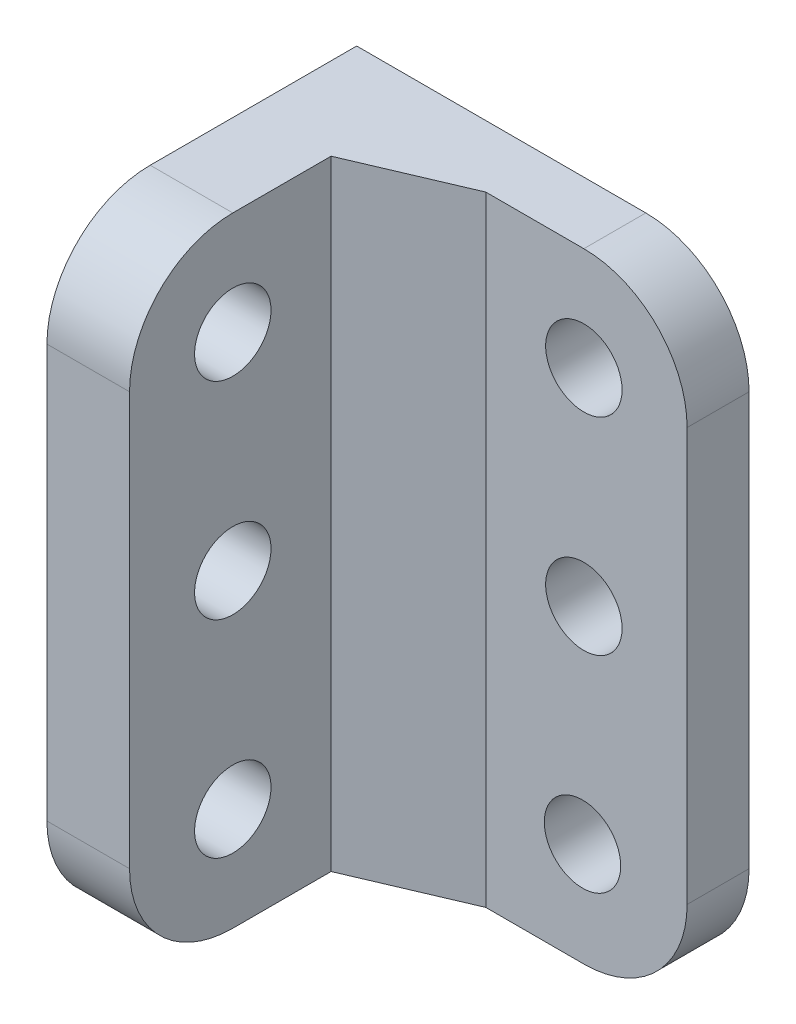
from build123d import *

# Parameters (mm, degrees)
BASE_EXTRUDE_DEPTH      = 38.1
SKETCH2_R               = 2.3495
MOTOR_HOLE_CUT_DEPTH    = 48.603828628
SKETCH3_R               = 2.3495
MOUNTING_HOLE_CUT_DEPTH = 47.6627796
CORNER_FILLETS_R        = 6.35


with BuildPart() as part:
    # Sketch1 → Base Extrude (new body)
    with BuildSketch(Plane(origin=(0, 0, 0), x_dir=(1, 0, 0), z_dir=(0, 1, 0))):
        Polygon((0, 0), (24.13, 0), (24.13, -3.81), (11.7475, -3.81), (5.08, -6.6548), (5.08, -19.05), (0, -19.05), align=None)
    extrude(amount=BASE_EXTRUDE_DEPTH)

    # Sketch2 → Motor Hole Cut (cut, through all)
    with BuildSketch(Plane.XY.offset(3.81)):
        with Locations((17.697323232, 6.35)):
            Circle(SKETCH2_R)
        with Locations((17.78, 19.05)):
            Circle(SKETCH2_R)
        with Locations((17.78, 31.75)):
            Circle(SKETCH2_R)
    extrude(amount=-MOTOR_HOLE_CUT_DEPTH, mode=Mode.SUBTRACT)

    # Sketch3 → Mounting Hole Cut (cut, through all)
    with BuildSketch(Plane(origin=(5.08, 0, 0), x_dir=(0, 0, -1), z_dir=(1, 0, 0))):
        with Locations((-12.7, 31.75)):
            Circle(SKETCH3_R)
        with Locations((-12.7, 19.05)):
            Circle(SKETCH3_R)
        with Locations((-12.7, 6.35)):
            Circle(SKETCH3_R)
    extrude(amount=-MOUNTING_HOLE_CUT_DEPTH, mode=Mode.SUBTRACT)

    # Corner Fillets
    corner_fillets_edges = [part.edges().sort_by_distance(p)[0] for p in [
        (24.13, 38.1, 1.905),
        (24.13, 0, 1.905),
        (2.54, 38.1, 19.05),
        (2.54, 0, 19.05),
    ]]
    fillet(corner_fillets_edges, radius=CORNER_FILLETS_R)


solid = part.part
